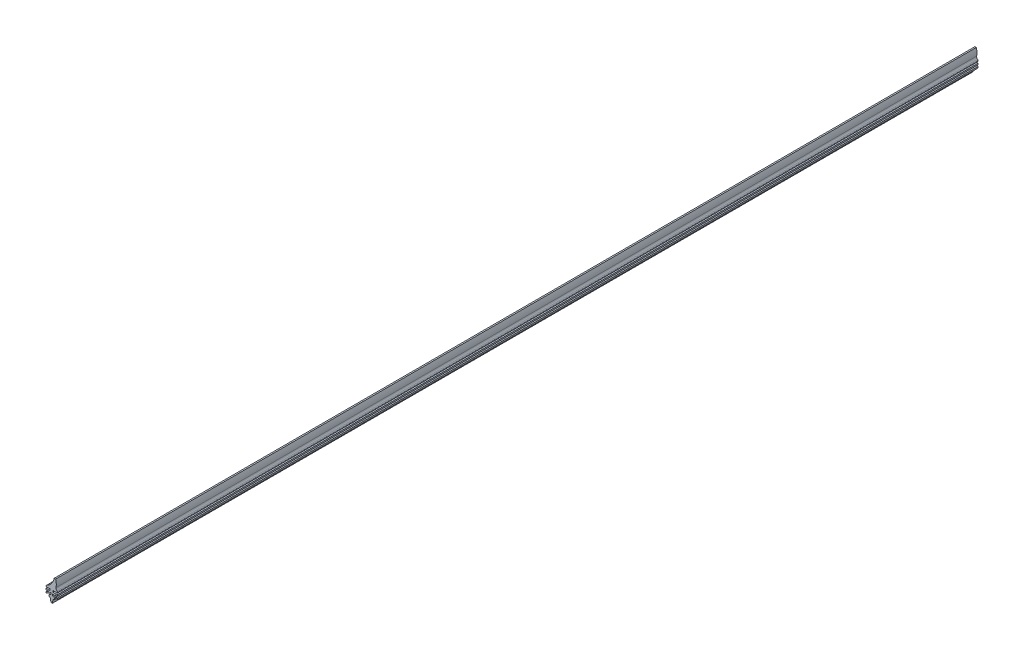
from build123d import *

# Parameters (mm, degrees)
EXTRUSION1_DEPTH = 650


with BuildPart() as part:
    # Esquisse1 → Extrusion1 (new body)
    with BuildSketch(Plane.XY):
        with BuildLine():
            Line((4, 0), (1, 0))
            Line((1, 0), (1, 1))
            Line((1, 1), (4, 1))
            Line((4, 1), (4, 1.5))
            ThreePointArc((4, 1.5), (3.894427191, 1.947213595), (3.6, 2.3))
            ThreePointArc((3.6, 2.3), (3.093760184, 2.977994654), (3.034989317, 3.822092686))
            ThreePointArc((3.034989317, 3.822092686), (3.257790087, 6.426670848), (2.797958971, 9))
            Line((2.797958971, 9), (1.797958971, 9))
            ThreePointArc((1.797958971, 9), (-0.040046913, 4.946972092), (-3.454545455, 2.092764572))
            ThreePointArc((-3.454545455, 2.092764572), (-3.852802865, 1.724273997), (-4, 1.202041029))
            Line((-4, 1.202041029), (-4, 1))
            Line((-4, 1), (-1, 1))
            Line((-1, 1), (-1, 0))
            Line((-1, 0), (-4, 0))
            Line((-4, 0), (-4, -1))
            Line((-4, -1), (-2.264690261, -1))
            Line((-2.264690261, -1), (-4, -2))
            Line((-4, -2), (-4, -3))
            Line((-4, -3), (-0.5, -0.983069005))
            Line((-0.5, -0.983069005), (-0.5, -2.13722779))
            Line((-0.5, -2.13722779), (-2, -3.001626788))
            Line((-2, -3.001626788), (-2, -4.001626788))
            Line((-2, -4.001626788), (-1.847051532, -4.001626788))
            ThreePointArc((-1.847051532, -4.001626788), (-1.200710202, -4.238578372), (-0.860672076, -4.837141017))
            Line((-0.860672076, -4.837141017), (-0.5, -7))
            Line((-0.5, -7), (0.5, -7))
            Line((0.5, -7), (0.860672076, -4.837141017))
            ThreePointArc((0.860672076, -4.837141017), (1.200710202, -4.238578372), (1.847051532, -4.001626788))
            Line((1.847051532, -4.001626788), (2, -4.001626788))
            Line((2, -4.001626788), (2, -3.001626788))
            Line((2, -3.001626788), (0.5, -2.13722779))
            Line((0.5, -2.13722779), (0.5, -0.983069005))
            Line((0.5, -0.983069005), (4, -3))
            Line((4, -3), (4, -2))
            Line((4, -2), (2.264690261, -1))
            Line((2.264690261, -1), (4, -1))
            Line((4, -1), (4, 0))
        make_face()
    extrude(amount=-EXTRUSION1_DEPTH)


solid = part.part
